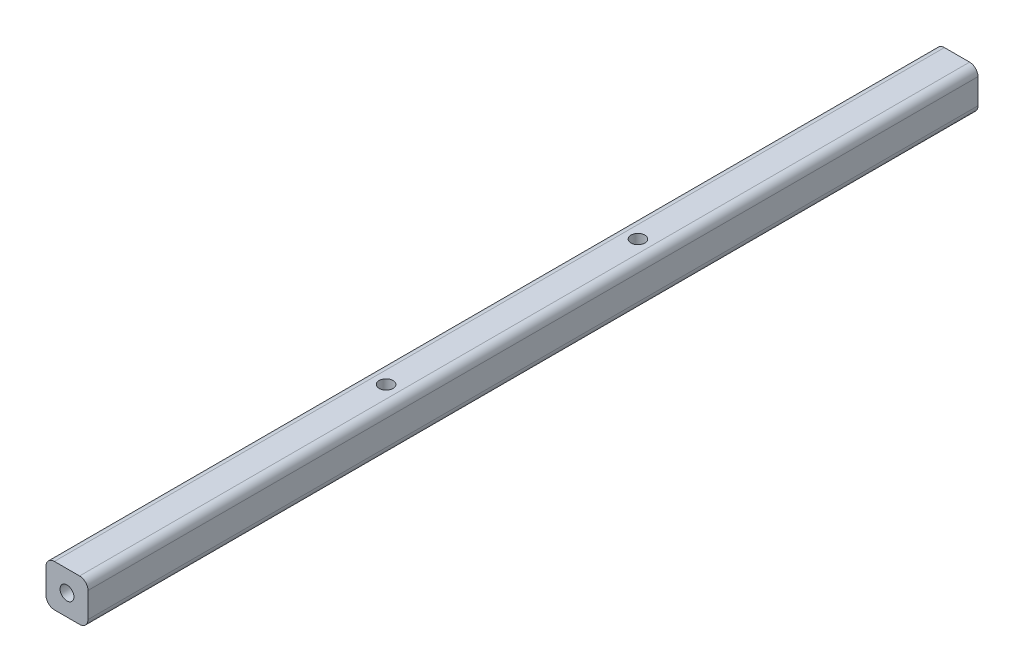
from build123d import *

# Parameters (mm, degrees)
ESQUISSE1_W           = 10
ESQUISSE1_H           = 10
BOSS_EXTRU_1_DEPTH    = 106
TROU_TARAUD_M41_D     = 3.3
TROU_TARAUD_M41_DEPTH = 11.5
TROU_TARAUD_M41_TIP   = 0.991420021
TROU_TARAUD_M42_D     = 3.3
TROU_TARAUD_M42_DEPTH = 11.5
TROU_TARAUD_M42_TIP   = 0.991420021
CONG_1_R              = 2
TROU_TARAUD_M44_D     = 3.3


with BuildPart() as part:
    # Esquisse1 → Boss.-Extru.1 (new, symmetric)
    with BuildSketch(Plane.XY):
        Rectangle(ESQUISSE1_W, ESQUISSE1_H)
    extrude(amount=BOSS_EXTRU_1_DEPTH, both=True)

    # Trou taraudé M41
    with Locations(Plane.XY.offset(106)):
        with Locations((0, 0)):
            Hole(TROU_TARAUD_M41_D / 2, depth=TROU_TARAUD_M41_DEPTH)
            with Locations((0, 0, -(TROU_TARAUD_M41_DEPTH + TROU_TARAUD_M41_TIP / 2))):  # 118° drill point
                Cone(0, TROU_TARAUD_M41_D / 2, TROU_TARAUD_M41_TIP, mode=Mode.SUBTRACT)

    # Trou taraudé M42
    with Locations(Plane(origin=(0, 0, -106), x_dir=(-1, 0, 0), z_dir=(0, 0, -1))):
        with Locations((0, 0)):
            Hole(TROU_TARAUD_M42_D / 2, depth=TROU_TARAUD_M42_DEPTH)
            with Locations((0, 0, -(TROU_TARAUD_M42_DEPTH + TROU_TARAUD_M42_TIP / 2))):  # 118° drill point
                Cone(0, TROU_TARAUD_M42_D / 2, TROU_TARAUD_M42_TIP, mode=Mode.SUBTRACT)

    # Congé1
    cong_1_edges = [part.edges().sort_by_distance(p)[0] for p in [
        (-5, 5, 0),
        (5, 5, 0),
        (5, -5, 0),
        (-5, -5, 0),
    ]]
    fillet(cong_1_edges, radius=CONG_1_R)

    # Trou taraudé M44 (through all)
    with Locations(Plane(origin=(0, 5, 0), x_dir=(1, 0, 0), z_dir=(0, 1, 0))):
        with Locations((0, -30), (0, 30)):
            Hole(TROU_TARAUD_M44_D / 2)


solid = part.part
